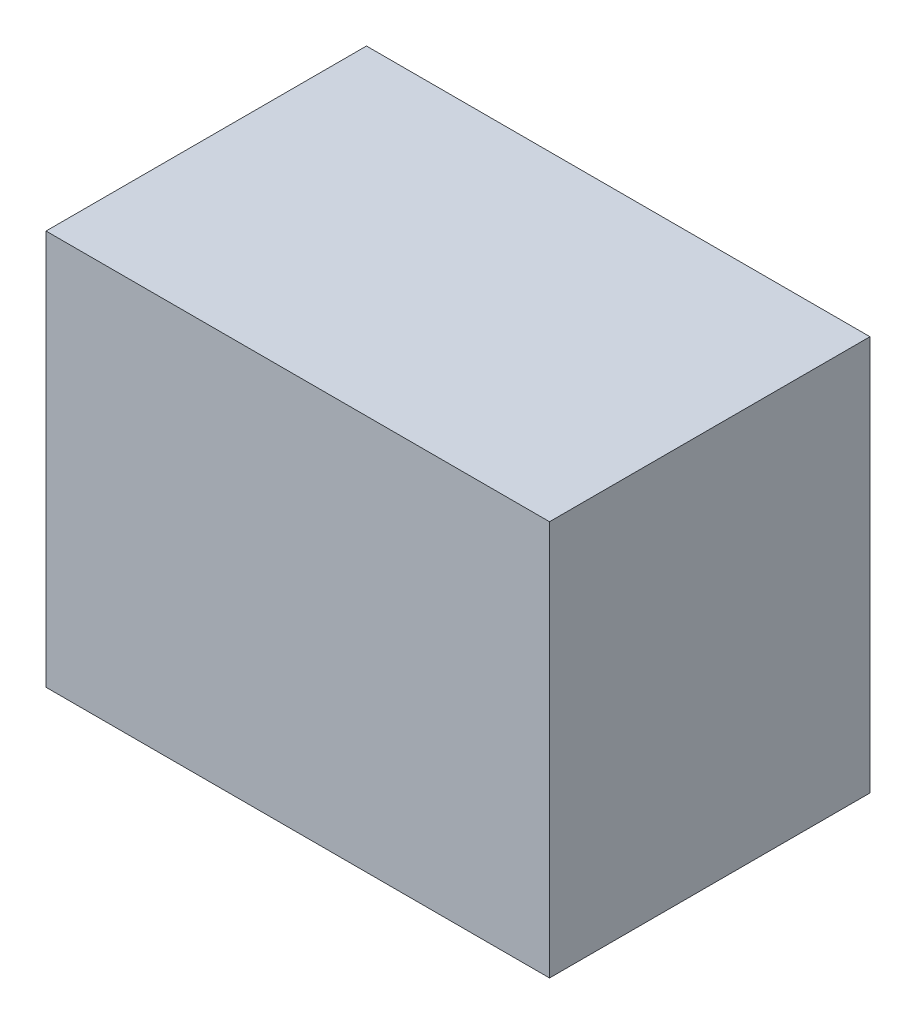
from build123d import *

# Parameters (mm, degrees)
SKETCH1_W           = 54.6
SKETCH1_H           = 34.75
BOSS_EXTRUDE1_DEPTH = 42.85


with BuildPart() as part:
    # Sketch1 → Boss-Extrude1 (new body)
    with BuildSketch(Plane(origin=(0, 0, 0), x_dir=(1, 0, 0), z_dir=(0, 1, 0))):
        Rectangle(SKETCH1_W, SKETCH1_H)
    extrude(amount=BOSS_EXTRUDE1_DEPTH)


solid = part.part
